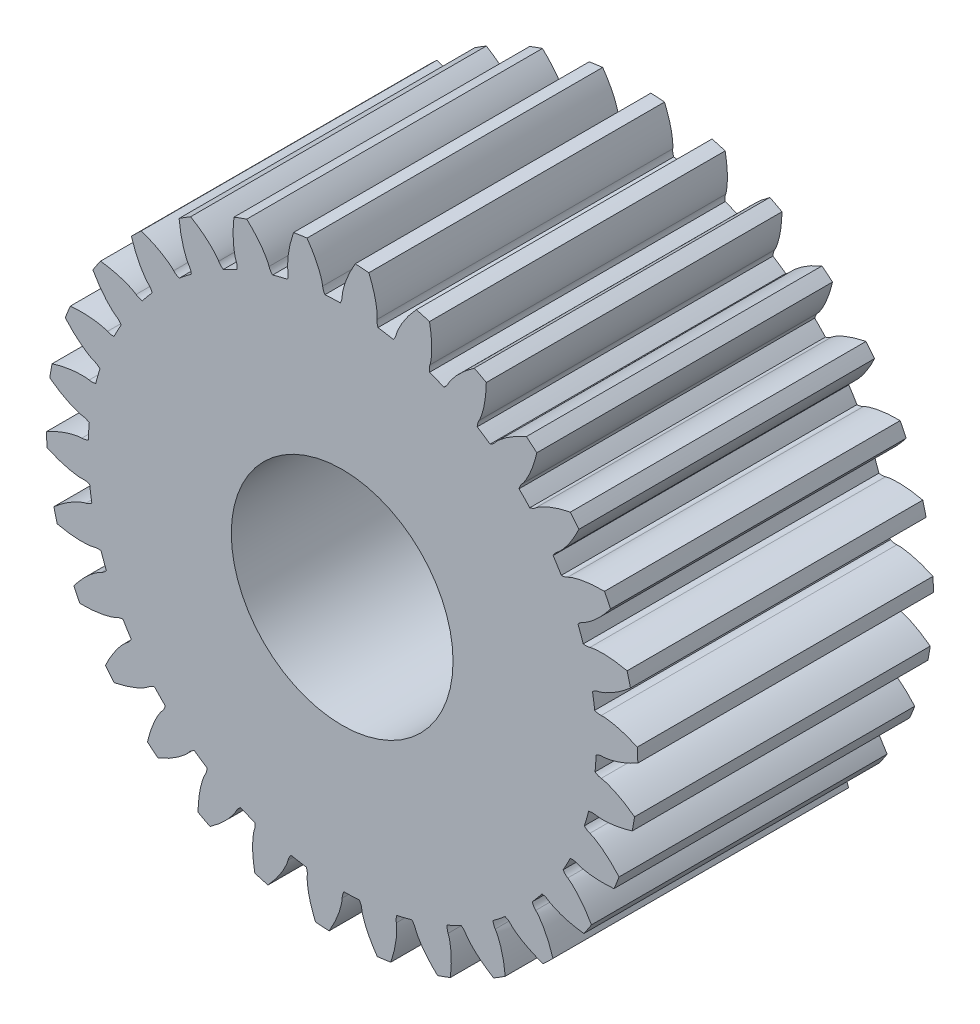
from build123d import *

# Parameters (mm, degrees)
EXTRUDE_1_DEPTH     = 8
SKETCH_4_R          = 3
CUT_EXTRUDE_1_DEPTH = 14.851437199


with BuildPart() as part:
    # 草图3 → 凸台-拉伸1 (new body)
    with BuildSketch(Plane.XY):
        with BuildLine():
            ThreePointArc((1.381076377, 6.734853602), (1.176200607, 6.773638397), (0.970242882, 6.806192309))
            add(Edge.make_bspline(
                [(0.944497299, 6.984119444), (0.936839109, 6.916691873), (0.949749676, 6.866361496), (0.970242882, 6.806192309)],
                knots=[0, 0, 0, 0, 1, 1, 1, 1], degree=3))
            add(Edge.make_bspline(
                [(0.944497299, 6.984119444), (0.945142268, 6.989798162), (0.946561124, 7.00576453), (0.947701168, 7.0360839), (0.947363048, 7.085626133), (0.943703552, 7.14876082), (0.935270102, 7.23020177), (0.92058926, 7.325773574), (0.899506223, 7.430213644), (0.871268355, 7.542993484), (0.838441416, 7.654599195), (0.801404333, 7.764937365), (0.767068505, 7.856734121), (0.741218568, 7.920699628), (0.725758466, 7.957461835), (0.72153722, 7.96739506)],
                knots=[0, 0, 0, 0, 0, 0.005376748, 0.015083688, 0.02853182, 0.046610139, 0.064854849, 0.092110525, 0.119476175, 0.146842495, 0.174208853, 0.201574955, 0.228941013, 0.239096509, 0.239096509, 0.239096509, 0.239096509, 0.239096509], degree=4))
            ThreePointArc((0.72153722, 7.96739506), (0.537273302, 7.981938198), (0.352722576, 7.992220391))
            add(Edge.make_bspline(
                [(3e-09, 7.047694627), (0.000121885, 7.053408555), (0.000855562, 7.069421043), (0.003789055, 7.099619693), (0.01076353, 7.148669708), (0.022851015, 7.210744448), (0.042122704, 7.290320534), (0.069479177, 7.383062758), (0.104368573, 7.48373526), (0.147465914, 7.591713447), (0.194953579, 7.697913091), (0.246443538, 7.802292404), (0.292771781, 7.888659571), (0.326960876, 7.948583782), (0.347208206, 7.982942482), (0.352722576, 7.992220391)],
                knots=[0, 0, 0, 0, 0, 0.005376748, 0.015083688, 0.02853182, 0.046610139, 0.064854849, 0.092110525, 0.119476175, 0.146842495, 0.174208853, 0.201574955, 0.228941013, 0.239096509, 0.239096509, 0.239096509, 0.239096509, 0.239096509], degree=4))
            add(Edge.make_bspline(
                [(3e-09, 7.047694627), (-0.001447201, 6.979848988), (-0.020986335, 6.931702837), (-0.049358256, 6.874822817)],
                knots=[0, 0, 0, 0, 1, 1, 1, 1], degree=3))
            ThreePointArc((-0.049358256, 6.874822817), (-0.257820811, 6.870164003), (-0.466046203, 6.859185516))
            add(Edge.make_bspline(
                [(-0.528222316, 7.027871708), (-0.521694176, 6.960325364), (-0.498601461, 6.913779085), (-0.466046203, 6.859185516)],
                knots=[0, 0, 0, 0, 1, 1, 1, 1], degree=3))
            add(Edge.make_bspline(
                [(-0.528222316, 7.027871708), (-0.528772113, 7.033560429), (-0.530703857, 7.04947289), (-0.535892477, 7.079366737), (-0.546523617, 7.127756055), (-0.563229584, 7.188750246), (-0.588411269, 7.266658103), (-0.622641795, 7.357089115), (-0.664978428, 7.454863509), (-0.716047479, 7.559307856), (-0.771361202, 7.66164961), (-0.830529531, 7.761876183), (-0.883200657, 7.84452814), (-0.921784888, 7.901721343), (-0.944550442, 7.934465872), (-0.950744678, 7.943304385)],
                knots=[0, 0, 0, 0, 0, 0.005376748, 0.015083688, 0.02853182, 0.046610139, 0.064854849, 0.092110525, 0.119476175, 0.146842495, 0.174208853, 0.201574955, 0.228941013, 0.239096509, 0.239096509, 0.239096509, 0.239096509, 0.239096509], degree=4))
            ThreePointArc((-0.950744678, 7.943304385), (-1.134005675, 7.919219098), (-1.316661313, 7.890906348))
            add(Edge.make_bspline(
                [(-1.465298104, 6.893685591), (-1.466366877, 6.899299996), (-1.468978416, 6.915115113), (-1.47238768, 6.945263758), (-1.475763685, 6.994691987), (-1.476846405, 7.057923374), (-1.474540646, 7.139767341), (-1.467064171, 7.236170656), (-1.453868183, 7.341897136), (-1.434162549, 7.456476181), (-1.409792751, 7.570228348), (-1.38112965, 7.683032088), (-1.353770534, 7.777144108), (-1.332787498, 7.842867144), (-1.320126195, 7.880684681), (-1.316661313, 7.890906348)],
                knots=[0, 0, 0, 0, 0, 0.005376748, 0.015083688, 0.02853182, 0.046610139, 0.064854849, 0.092110525, 0.119476175, 0.146842495, 0.174208853, 0.201574955, 0.228941013, 0.239096509, 0.239096509, 0.239096509, 0.239096509, 0.239096509], degree=4))
            add(Edge.make_bspline(
                [(-1.465298104, 6.893685591), (-1.452607781, 6.827021651), (-1.46170979, 6.775865195), (-1.477635695, 6.714329285)],
                knots=[0, 0, 0, 0, 1, 1, 1, 1], degree=3))
            ThreePointArc((-1.477635695, 6.714329285), (-1.680574221, 6.666430476), (-1.881966834, 6.612399401))
            add(Edge.make_bspline(
                [(-1.977856081, 6.764472255), (-1.957426921, 6.699759237), (-1.925161323, 6.659031351), (-1.881966834, 6.612399401)],
                knots=[0, 0, 0, 0, 1, 1, 1, 1], degree=3))
            add(Edge.make_bspline(
                [(-1.977856081, 6.764472255), (-1.979576615, 6.769922354), (-1.984774532, 6.785085458), (-1.996065049, 6.813247278), (-2.016524578, 6.858368835), (-2.045546885, 6.91455679), (-2.086376244, 6.985526607), (-2.138660415, 7.066864558), (-2.20040033, 7.153700066), (-2.272068601, 7.2452442), (-2.347451634, 7.333849172), (-2.426165269, 7.419583766), (-2.494869713, 7.489478637), (-2.544501921, 7.537399919), (-2.573577964, 7.564695676), (-2.581474471, 7.572053193)],
                knots=[0, 0, 0, 0, 0, 0.005376748, 0.015083688, 0.02853182, 0.046610139, 0.064854849, 0.092110525, 0.119476175, 0.146842495, 0.174208853, 0.201574955, 0.228941013, 0.239096509, 0.239096509, 0.239096509, 0.239096509, 0.239096509], degree=4))
            ThreePointArc((-2.581474471, 7.572053193), (-2.755723163, 7.510392124), (-2.928500785, 7.444721832))
            add(Edge.make_bspline(
                [(-2.866555652, 6.438389415), (-2.86876837, 6.443658921), (-2.874610989, 6.458585471), (-2.884214007, 6.487366469), (-2.897792945, 6.535012662), (-2.91199855, 6.596637181), (-2.926759496, 6.677172056), (-2.939489775, 6.773023174), (-2.948563922, 6.879182876), (-2.953111226, 6.995355126), (-2.952924373, 7.111688301), (-2.948340846, 7.227986403), (-2.941146581, 7.325730129), (-2.934286662, 7.394379578), (-2.929764747, 7.434003143), (-2.928500785, 7.444721832)],
                knots=[0, 0, 0, 0, 0, 0.005376748, 0.015083688, 0.02853182, 0.046610139, 0.064854849, 0.092110525, 0.119476175, 0.146842495, 0.174208853, 0.201574955, 0.228941013, 0.239096509, 0.239096509, 0.239096509, 0.239096509, 0.239096509], degree=4))
            add(Edge.make_bspline(
                [(-2.866555652, 6.438389415), (-2.84028243, 6.375820708), (-2.838549514, 6.323889729), (-2.841333365, 6.260387345)],
                knots=[0, 0, 0, 0, 1, 1, 1, 1], degree=3))
            ThreePointArc((-2.841333365, 6.260387345), (-3.029878474, 6.171341947), (-3.215636483, 6.076619703))
            add(Edge.make_bspline(
                [(-3.341048044, 6.205432904), (-3.307610718, 6.146381482), (-3.267582396, 6.113251993), (-3.215636483, 6.076619703)],
                knots=[0, 0, 0, 0, 1, 1, 1, 1], degree=3))
            add(Edge.make_bspline(
                [(-3.341048044, 6.205432904), (-3.34386412, 6.210406187), (-3.352101037, 6.224157233), (-3.369, 6.249356219), (-3.398393738, 6.289237986), (-3.438463971, 6.338164023), (-3.493156565, 6.399094078), (-3.561209313, 6.467784109), (-3.63965418, 6.539885602), (-3.728789423, 6.614528607), (-3.820947165, 6.685524333), (-3.915765943, 6.753019936), (-3.997500991, 6.807102979), (-4.056012011, 6.843657949), (-4.090127779, 6.86431198), (-4.099381443, 6.869866941)],
                knots=[0, 0, 0, 0, 0, 0.005376748, 0.015083688, 0.02853182, 0.046610139, 0.064854849, 0.092110525, 0.119476175, 0.146842495, 0.174208853, 0.201574955, 0.228941013, 0.239096509, 0.239096509, 0.239096509, 0.239096509, 0.239096509], degree=4))
            ThreePointArc((-4.099381443, 6.869866941), (-4.257002325, 6.773324974), (-4.412350721, 6.673167248))
            add(Edge.make_bspline(
                [(-4.142530962, 5.701704726), (-4.14579092, 5.706399031), (-4.154609267, 5.719784651), (-4.169986343, 5.745940136), (-4.193174749, 5.789721925), (-4.219882385, 5.84704629), (-4.25106491, 5.922752311), (-4.283445571, 6.013862078), (-4.314393269, 6.115815315), (-4.342994773, 6.228503484), (-4.36699903, 6.34233335), (-4.386695399, 6.457043028), (-4.39998041, 6.554146591), (-4.407543419, 6.622722142), (-4.411358521, 6.662419996), (-4.412350721, 6.673167248)],
                knots=[0, 0, 0, 0, 0, 0.005376748, 0.015083688, 0.02853182, 0.046610139, 0.064854849, 0.092110525, 0.119476175, 0.146842495, 0.174208853, 0.201574955, 0.228941013, 0.239096509, 0.239096509, 0.239096509, 0.239096509, 0.239096509], degree=4))
            add(Edge.make_bspline(
                [(-4.142530962, 5.701704726), (-4.103823108, 5.645965806), (-4.091331002, 5.595529937), (-4.080851131, 5.532836437)],
                knots=[0, 0, 0, 0, 1, 1, 1, 1], degree=3))
            ThreePointArc((-4.080851131, 5.532836437), (-4.246762499, 5.406536162), (-4.408767388, 5.275262564))
            add(Edge.make_bspline(
                [(-4.558220175, 5.375186359), (-4.513236054, 5.324377363), (-4.467194439, 5.300294189), (-4.408767388, 5.275262564)],
                knots=[0, 0, 0, 0, 1, 1, 1, 1], degree=3))
            add(Edge.make_bspline(
                [(-4.558220175, 5.375186359), (-4.562008717, 5.379465468), (-4.572924641, 5.391203469), (-4.594693485, 5.412338305), (-4.631736785, 5.445237258), (-4.681103682, 5.484763074), (-4.747269183, 5.532990431), (-4.828116275, 5.586030459), (-4.919837677, 5.640246757), (-5.022544254, 5.694726373), (-5.12744897, 5.745010001), (-5.234228855, 5.79131673), (-5.325422293, 5.827224257), (-5.390254912, 5.850815288), (-5.427919384, 5.863924912), (-5.438125774, 5.867434539)],
                knots=[0, 0, 0, 0, 0, 0.005376748, 0.015083688, 0.02853182, 0.046610139, 0.064854849, 0.092110525, 0.119476175, 0.146842495, 0.174208853, 0.201574955, 0.228941013, 0.239096509, 0.239096509, 0.239096509, 0.239096509, 0.239096509], degree=4))
            ThreePointArc((-5.438125774, 5.867434539), (-5.572230059, 5.740231021), (-5.703359757, 5.609963234))
            add(Edge.make_bspline(
                [(-5.237457792, 4.715828181), (-5.241622512, 4.719742122), (-5.253031184, 4.731001796), (-5.273510265, 4.753388647), (-5.305294695, 4.791392558), (-5.343337111, 4.841911418), (-5.38957839, 4.909479869), (-5.440194241, 4.991866351), (-5.491662928, 5.085157277), (-5.543068608, 5.189436353), (-5.590214874, 5.295787997), (-5.633330313, 5.403895888), (-5.666513981, 5.496115396), (-5.688169379, 5.561619969), (-5.70015476, 5.599657125), (-5.703359757, 5.609963234)],
                knots=[0, 0, 0, 0, 0, 0.005376748, 0.015083688, 0.02853182, 0.046610139, 0.064854849, 0.092110525, 0.119476175, 0.146842495, 0.174208853, 0.201574955, 0.228941013, 0.239096509, 0.239096509, 0.239096509, 0.239096509, 0.239096509], degree=4))
            add(Edge.make_bspline(
                [(-5.237457792, 4.715828181), (-5.188007024, 4.669355106), (-5.165301694, 4.622618636), (-5.142016122, 4.563474028)],
                knots=[0, 0, 0, 0, 1, 1, 1, 1], degree=3))
            ThreePointArc((-5.142016122, 4.563474028), (-5.278042624, 4.405438804), (-5.409214002, 4.243351139))
            add(Edge.make_bspline(
                [(-5.576176212, 4.310018377), (-5.521611318, 4.269672404), (-5.471568649, 4.255688095), (-5.409214002, 4.243351139)],
                knots=[0, 0, 0, 0, 1, 1, 1, 1], degree=3))
            add(Edge.make_bspline(
                [(-5.576176212, 4.310018377), (-5.580771642, 4.313416295), (-5.593889494, 4.322628245), (-5.619576816, 4.338775236), (-5.662650709, 4.363253533), (-5.7191567, 4.39165166), (-5.793903357, 4.425068553), (-5.884011388, 4.460140472), (-5.98500066, 4.494102062), (-6.096789801, 4.526037271), (-6.209856651, 4.553411163), (-6.32393085, 4.576505193), (-6.420597087, 4.592667873), (-6.488917809, 4.602263924), (-6.528484866, 4.607256186), (-6.539197914, 4.608567092)],
                knots=[0, 0, 0, 0, 0, 0.005376748, 0.015083688, 0.02853182, 0.046610139, 0.064854849, 0.092110525, 0.119476175, 0.146842495, 0.174208853, 0.201574955, 0.228941013, 0.239096509, 0.239096509, 0.239096509, 0.239096509, 0.239096509], degree=4))
            ThreePointArc((-6.539197914, 4.608567092), (-6.6439246, 4.456261428), (-6.745104603, 4.301576907))
            add(Edge.make_bspline(
                [(-6.103482584, 3.523847316), (-6.108370049, 3.526809833), (-6.121870432, 3.53545146), (-6.146556484, 3.553091264), (-6.185547805, 3.583656344), (-6.233262365, 3.625161783), (-6.292541432, 3.681639599), (-6.359180318, 3.751702111), (-6.428920564, 3.832253465), (-6.500883746, 3.923565951), (-6.569111503, 4.017791297), (-6.633761661, 4.114572567), (-6.6853937, 4.197877586), (-6.720195042, 4.257448316), (-6.739826883, 4.292162368), (-6.745104603, 4.301576907)],
                knots=[0, 0, 0, 0, 0, 0.005376748, 0.015083688, 0.02853182, 0.046610139, 0.064854849, 0.092110525, 0.119476175, 0.146842495, 0.174208853, 0.201574955, 0.228941013, 0.239096509, 0.239096509, 0.239096509, 0.239096509, 0.239096509], degree=4))
            add(Edge.make_bspline(
                [(-6.103482584, 3.523847316), (-6.045450138, 3.488671181), (-6.013523916, 3.44767672), (-5.978450334, 3.394665905)],
                knots=[0, 0, 0, 0, 1, 1, 1, 1], degree=3))
            ThreePointArc((-5.978450334, 3.394665905), (-6.07864696, 3.21180263), (-6.173252007, 3.025984906))
            add(Edge.make_bspline(
                [(-6.350426592, 3.05648191), (-6.288665672, 3.028362273), (-6.236809054, 3.02508801), (-6.173252007, 3.025984906)],
                knots=[0, 0, 0, 0, 1, 1, 1, 1], degree=3))
            add(Edge.make_bspline(
                [(-6.350426592, 3.05648191), (-6.355628067, 3.058850132), (-6.370374535, 3.065133423), (-6.398857676, 3.07558687), (-6.446079624, 3.090574691), (-6.507255126, 3.106603995), (-6.587316152, 3.123749944), (-6.682746969, 3.139320946), (-6.788590394, 3.151543543), (-6.904576378, 3.159538621), (-7.020863798, 3.162806408), (-7.137246721, 3.161678419), (-7.235160979, 3.157389864), (-7.30398386, 3.152571542), (-7.343724231, 3.149228258), (-7.354475727, 3.148283149)],
                knots=[0, 0, 0, 0, 0, 0.005376748, 0.015083688, 0.02853182, 0.046610139, 0.064854849, 0.092110525, 0.119476175, 0.146842495, 0.174208853, 0.201574955, 0.228941013, 0.239096509, 0.239096509, 0.239096509, 0.239096509, 0.239096509], degree=4))
            ThreePointArc((-7.354475727, 3.148283149), (-7.425247755, 2.977531827), (-7.492056012, 2.805191028))
            add(Edge.make_bspline(
                [(-6.702755899, 2.177857413), (-6.708152503, 2.179739031), (-6.723154566, 2.185384931), (-6.75096869, 2.197506744), (-6.795462795, 2.219297152), (-6.850764142, 2.249975183), (-6.920490218, 2.292894012), (-7.0002397, 2.347570487), (-7.085203523, 2.411861788), (-7.17457907, 2.48621689), (-7.260906438, 2.564197837), (-7.344265792, 2.645422681), (-7.412089634, 2.716172381), (-7.458515934, 2.767205741), (-7.48493623, 2.797079519), (-7.492056012, 2.805191028)],
                knots=[0, 0, 0, 0, 0, 0.005376748, 0.015083688, 0.02853182, 0.046610139, 0.064854849, 0.092110525, 0.119476175, 0.146842495, 0.174208853, 0.201574955, 0.228941013, 0.239096509, 0.239096509, 0.239096509, 0.239096509, 0.239096509], degree=4))
            add(Edge.make_bspline(
                [(-6.702755899, 2.177857413), (-6.638678072, 2.155515586), (-6.598926286, 2.122054786), (-6.553597578, 2.077494593)],
                knots=[0, 0, 0, 0, 1, 1, 1, 1], degree=3))
            ThreePointArc((-6.553597578, 2.077494593), (-6.613585255, 1.877795269), (-6.667489278, 1.676368613))
            add(Edge.make_bspline(
                [(-6.847132856, 1.669362516), (-6.780875159, 1.654698179), (-6.729470976, 1.662277064), (-6.667489278, 1.676368613)],
                knots=[0, 0, 0, 0, 1, 1, 1, 1], degree=3))
            add(Edge.make_bspline(
                [(-6.847132856, 1.669362516), (-6.852713048, 1.67059754), (-6.86844364, 1.673677563), (-6.898477749, 1.677980599), (-6.947783928, 1.682822905), (-7.010955278, 1.685782828), (-7.092831622, 1.685908474), (-7.18941444, 1.681298029), (-7.295486153, 1.671247448), (-7.410599835, 1.654952973), (-7.525025507, 1.633971837), (-7.638630662, 1.608671126), (-7.733513618, 1.584118768), (-7.799830769, 1.565096656), (-7.838007609, 1.553563943), (-7.848327659, 1.550404125)],
                knots=[0, 0, 0, 0, 0, 0.005376748, 0.015083688, 0.02853182, 0.046610139, 0.064854849, 0.092110525, 0.119476175, 0.146842495, 0.174208853, 0.201574955, 0.228941013, 0.239096509, 0.239096509, 0.239096509, 0.239096509, 0.239096509], degree=4))
            ThreePointArc((-7.848327659, 1.550404125), (-7.882051953, 1.368669797), (-7.911568623, 1.186204841))
            add(Edge.make_bspline(
                [(-7.009086618, 0.736684692), (-7.014756504, 0.737403175), (-7.030604584, 0.739806593), (-7.06033117, 0.745880634), (-7.108383452, 0.757944025), (-7.168854654, 0.77645387), (-7.245980373, 0.803937954), (-7.335355016, 0.840838767), (-7.431829089, 0.886060177), (-7.534710861, 0.940208221), (-7.635364919, 0.998536628), (-7.733790266, 1.06065513), (-7.814841684, 1.115757409), (-7.870863891, 1.156022998), (-7.902917947, 1.179750873), (-7.911568623, 1.186204841)],
                knots=[0, 0, 0, 0, 0, 0.005376748, 0.015083688, 0.02853182, 0.046610139, 0.064854849, 0.092110525, 0.119476175, 0.146842495, 0.174208853, 0.201574955, 0.228941013, 0.239096509, 0.239096509, 0.239096509, 0.239096509, 0.239096509], degree=4))
            add(Edge.make_bspline(
                [(-7.009086618, 0.736684692), (-6.941763918, 0.728153616), (-6.895923913, 0.703688876), (-6.842321161, 0.669526798)],
                knots=[0, 0, 0, 0, 1, 1, 1, 1], degree=3))
            ThreePointArc((-6.842321161, 0.669526798), (-6.859478139, 0.461719244), (-6.870325273, 0.253486968))
            add(Edge.make_bspline(
                [(-7.044586558, 0.209283971), (-6.976727864, 0.208715834), (-6.928022724, 0.226816633), (-6.870325273, 0.253486968)],
                knots=[0, 0, 0, 0, 1, 1, 1, 1], degree=3))
            add(Edge.make_bspline(
                [(-7.044586558, 0.209283971), (-7.050301585, 0.209331819), (-7.066328799, 0.209073963), (-7.096601243, 0.207038524), (-7.145836736, 0.201523683), (-7.208243042, 0.191284863), (-7.288356315, 0.174384714), (-7.381870001, 0.149794321), (-7.48353416, 0.11790982), (-7.592744519, 0.078037938), (-7.700307493, 0.033724855), (-7.806169789, -0.014642814), (-7.893874602, -0.05838592), (-7.954787644, -0.090780465), (-7.989732444, -0.109998572), (-7.999170013, -0.115234999)],
                knots=[0, 0, 0, 0, 0, 0.005376748, 0.015083688, 0.02853182, 0.046610139, 0.064854849, 0.092110525, 0.119476175, 0.146842495, 0.174208853, 0.201574955, 0.228941013, 0.239096509, 0.239096509, 0.239096509, 0.239096509, 0.239096509], degree=4))
            ThreePointArc((-7.999170013, -0.115234999), (-7.994372658, -0.300009671), (-7.985307721, -0.48462419))
            add(Edge.make_bspline(
                [(-7.009086619, -0.736684686), (-7.014781985, -0.737160739), (-7.030783446, -0.738104842), (-7.061123298, -0.738344038), (-7.110633643, -0.736534893), (-7.173631816, -0.731002202), (-7.254786416, -0.72015405), (-7.34988012, -0.702641642), (-7.453648062, -0.678466516), (-7.565539631, -0.646892059), (-7.676121315, -0.610765423), (-7.785310995, -0.57046814), (-7.876047653, -0.533421515), (-7.939217327, -0.505683498), (-7.975504228, -0.489138546), (-7.985307721, -0.48462419)],
                knots=[0, 0, 0, 0, 0, 0.005376748, 0.015083688, 0.02853182, 0.046610139, 0.064854849, 0.092110525, 0.119476175, 0.146842495, 0.174208853, 0.201574955, 0.228941013, 0.239096509, 0.239096509, 0.239096509, 0.239096509, 0.239096509], degree=4))
            add(Edge.make_bspline(
                [(-7.009086619, -0.736684686), (-6.941461371, -0.731032161), (-6.891536574, -0.745431615), (-6.832002475, -0.76770253)],
                knots=[0, 0, 0, 0, 1, 1, 1, 1], degree=3))
            ThreePointArc((-6.832002475, -0.76770253), (-6.805578913, -0.974536127), (-6.772895086, -1.180473275))
            add(Edge.make_bspline(
                [(-6.934158024, -1.259941289), (-6.867664083, -1.246388395), (-6.823786635, -1.218556773), (-6.772895086, -1.180473275)],
                knots=[0, 0, 0, 0, 1, 1, 1, 1], degree=3))
            add(Edge.make_bspline(
                [(-6.934158024, -1.259941289), (-6.939758113, -1.261082707), (-6.955381482, -1.264667174), (-6.984569208, -1.272952128), (-7.031582188, -1.288583091), (-7.090495997, -1.311573169), (-7.165344864, -1.344760495), (-7.251702421, -1.388256117), (-7.344515813, -1.440581033), (-7.443049834, -1.502287729), (-7.539049091, -1.567996065), (-7.632541837, -1.637316793), (-7.709235387, -1.698338863), (-7.762082129, -1.742690043), (-7.792267631, -1.76875362), (-7.800410253, -1.7758378)],
                knots=[0, 0, 0, 0, 0, 0.005376748, 0.015083688, 0.02853182, 0.046610139, 0.064854849, 0.092110525, 0.119476175, 0.146842495, 0.174208853, 0.201574955, 0.228941013, 0.239096509, 0.239096509, 0.239096509, 0.239096509, 0.239096509], degree=4))
            ThreePointArc((-7.800410253, -1.7758378), (-7.757300917, -1.955577276), (-7.710050553, -2.134272819))
            add(Edge.make_bspline(
                [(-6.702755901, -2.177857409), (-6.708227833, -2.179507192), (-6.723683333, -2.183757555), (-6.753310455, -2.190299534), (-6.802115022, -2.198823701), (-6.864886846, -2.20650997), (-6.946523481, -2.212771867), (-7.043180193, -2.215413239), (-7.149706848, -2.213340966), (-7.265718017, -2.205720053), (-7.381394376, -2.193374095), (-7.496576275, -2.176659215), (-7.593032546, -2.15928736), (-7.660588869, -2.145289199), (-7.699522703, -2.136650265), (-7.710050553, -2.134272819)],
                knots=[0, 0, 0, 0, 0, 0.005376748, 0.015083688, 0.02853182, 0.046610139, 0.064854849, 0.092110525, 0.119476175, 0.146842495, 0.174208853, 0.201574955, 0.228941013, 0.239096509, 0.239096509, 0.239096509, 0.239096509, 0.239096509], degree=4))
            add(Edge.make_bspline(
                [(-6.702755901, -2.177857409), (-6.637783653, -2.158268325), (-6.585956018, -2.161973167), (-6.523092498, -2.171379574)],
                knots=[0, 0, 0, 0, 1, 1, 1, 1], degree=3))
            ThreePointArc((-6.523092498, -2.171379574), (-6.454243231, -2.368199593), (-6.379456884, -2.562841171))
            add(Edge.make_bspline(
                [(-6.520673511, -2.674101068), (-6.458450427, -2.647019469), (-6.421318326, -2.610673401), (-6.379456884, -2.562841171)],
                knots=[0, 0, 0, 0, 1, 1, 1, 1], degree=3))
            add(Edge.make_bspline(
                [(-6.520673511, -2.674101068), (-6.52591391, -2.676381867), (-6.540450618, -2.683136286), (-6.567277984, -2.697308663), (-6.610013757, -2.7223726), (-6.662860252, -2.75710916), (-6.729173458, -2.805133218), (-6.804600648, -2.865633102), (-6.884506883, -2.936111582), (-6.968058155, -3.016956214), (-7.048298067, -3.101188032), (-7.125335183, -3.188432171), (-7.187665592, -3.264066248), (-7.230136378, -3.318435704), (-7.254243332, -3.350205649), (-7.260735134, -3.358827968)],
                knots=[0, 0, 0, 0, 0, 0.005376748, 0.015083688, 0.02853182, 0.046610139, 0.064854849, 0.092110525, 0.119476175, 0.146842495, 0.174208853, 0.201574955, 0.228941013, 0.239096509, 0.239096509, 0.239096509, 0.239096509, 0.239096509], degree=4))
            ThreePointArc((-7.260735134, -3.358827968), (-7.181197902, -3.52567677), (-7.09782718, -3.690643484))
            add(Edge.make_bspline(
                [(-6.103482587, -3.523847311), (-6.108491934, -3.526598722), (-6.122725994, -3.533969583), (-6.150345539, -3.546528429), (-6.196311335, -3.565013363), (-6.256113379, -3.585582665), (-6.334664136, -3.608680935), (-6.428659495, -3.631360647), (-6.533289137, -3.651481795), (-6.64834966, -3.668147495), (-6.764065082, -3.680121794), (-6.880205199, -3.687719837), (-6.978165481, -3.690781985), (-7.047155917, -3.691135467), (-7.087035089, -3.690780114), (-7.09782718, -3.690643484)],
                knots=[0, 0, 0, 0, 0, 0.005376748, 0.015083688, 0.02853182, 0.046610139, 0.064854849, 0.092110525, 0.119476175, 0.146842495, 0.174208853, 0.201574955, 0.228941013, 0.239096509, 0.239096509, 0.239096509, 0.239096509, 0.239096509], degree=4))
            add(Edge.make_bspline(
                [(-6.103482587, -3.523847311), (-6.044002938, -3.491177806), (-5.992537581, -3.484026118), (-5.929092078, -3.480156912)],
                knots=[0, 0, 0, 0, 1, 1, 1, 1], degree=3))
            ThreePointArc((-5.929092078, -3.480156912), (-5.82082615, -3.658361373), (-5.707205804, -3.833200609))
            add(Edge.make_bspline(
                [(-5.822204276, -3.971389798), (-5.766971496, -3.931963091), (-5.738207593, -3.888691074), (-5.707205804, -3.833200609)],
                knots=[0, 0, 0, 0, 1, 1, 1, 1], degree=3))
            add(Edge.make_bspline(
                [(-5.822204276, -3.971389798), (-5.826855954, -3.974710297), (-5.839670678, -3.984339467), (-5.862965199, -4.003779867), (-5.899556007, -4.037181364), (-5.944025542, -4.082146251), (-5.998904883, -4.142908158), (-6.060105174, -4.217768169), (-6.123611967, -4.303319966), (-6.188528899, -4.399769235), (-6.249502596, -4.498843202), (-6.30671719, -4.600197764), (-6.351960321, -4.687138276), (-6.382198973, -4.749149801), (-6.399173789, -4.785237614), (-6.403731049, -4.795021236)],
                knots=[0, 0, 0, 0, 0, 0.005376748, 0.015083688, 0.02853182, 0.046610139, 0.064854849, 0.092110525, 0.119476175, 0.146842495, 0.174208853, 0.201574955, 0.228941013, 0.239096509, 0.239096509, 0.239096509, 0.239096509, 0.239096509], degree=4))
            ThreePointArc((-6.403731049, -4.795021236), (-6.29124208, -4.941687272), (-6.175394699, -5.085715319))
            add(Edge.make_bspline(
                [(-5.237457795, -4.715828177), (-5.241785627, -4.719560965), (-5.25417615, -4.729730182), (-5.27858101, -4.747757014), (-5.31969911, -4.775394835), (-5.373917737, -4.807948191), (-5.445949571, -4.846873329), (-5.533175529, -4.888600169), (-5.63133534, -4.930035348), (-5.740416521, -4.970259291), (-5.851113687, -5.006030511), (-5.963136141, -5.037609407), (-6.0583191, -5.060971728), (-6.125728437, -5.075661403), (-6.164810035, -5.083605161), (-6.175394699, -5.085715319)],
                knots=[0, 0, 0, 0, 0, 0.005376748, 0.015083688, 0.02853182, 0.046610139, 0.064854849, 0.092110525, 0.119476175, 0.146842495, 0.174208853, 0.201574955, 0.228941013, 0.239096509, 0.239096509, 0.239096509, 0.239096509, 0.239096509], degree=4))
            add(Edge.make_bspline(
                [(-5.237457795, -4.715828177), (-5.186070292, -4.671506065), (-5.137216496, -4.653810409), (-5.075961883, -4.636834692)],
                knots=[0, 0, 0, 0, 1, 1, 1, 1], degree=3))
            ThreePointArc((-5.075961883, -4.636834692), (-4.933011034, -4.788635207), (-4.785522444, -4.936030788))
            add(Edge.make_bspline(
                [(-4.869276775, -5.095109738), (-4.823448238, -5.045061059), (-4.804309653, -4.996754287), (-4.785522444, -4.936030788)],
                knots=[0, 0, 0, 0, 1, 1, 1, 1], degree=3))
            add(Edge.make_bspline(
                [(-4.869276775, -5.095109738), (-4.873136433, -5.099324814), (-4.883669107, -5.111407895), (-4.9024127, -5.135266679), (-4.93125935, -5.175545929), (-4.965408394, -5.228773962), (-5.006455378, -5.299618132), (-5.050754025, -5.385566528), (-5.095085823, -5.482452617), (-5.138531234, -5.590291228), (-5.177573873, -5.699877335), (-5.212465393, -5.81091264), (-5.238643904, -5.905359869), (-5.255328847, -5.972303263), (-5.264429645, -6.011131733), (-5.266853188, -6.021649068)],
                knots=[0, 0, 0, 0, 0, 0.005376748, 0.015083688, 0.02853182, 0.046610139, 0.064854849, 0.092110525, 0.119476175, 0.146842495, 0.174208853, 0.201574955, 0.228941013, 0.239096509, 0.239096509, 0.239096509, 0.239096509, 0.239096509], degree=4))
            ThreePointArc((-5.266853188, -6.021649068), (-5.12632879, -6.141722327), (-4.983067838, -6.258516991))
            add(Edge.make_bspline(
                [(-4.142530967, -5.701704723), (-4.145988134, -5.706255747), (-4.155993596, -5.718778877), (-4.176117162, -5.741485835), (-4.210590507, -5.777068637), (-4.256856103, -5.820183311), (-4.319220878, -5.873234102), (-4.395865241, -5.932184406), (-4.483265167, -5.993122699), (-4.581599634, -6.055146905), (-4.682440546, -6.113151673), (-4.78544942, -6.167331273), (-4.873695103, -6.20997272), (-4.936577229, -6.23835658), (-4.9731532, -6.25425227), (-4.983067838, -6.258516991)],
                knots=[0, 0, 0, 0, 0, 0.005376748, 0.015083688, 0.02853182, 0.046610139, 0.064854849, 0.092110525, 0.119476175, 0.146842495, 0.174208853, 0.201574955, 0.228941013, 0.239096509, 0.239096509, 0.239096509, 0.239096509, 0.239096509], degree=4))
            add(Edge.make_bspline(
                [(-4.142530967, -5.701704723), (-4.101481488, -5.647667093), (-4.057374399, -5.620200853), (-4.000987796, -5.590860547)],
                knots=[0, 0, 0, 0, 1, 1, 1, 1], degree=3))
            ThreePointArc((-4.000987796, -5.590860547), (-3.829599665, -5.709622703), (-3.65468879, -5.823132735))
            add(Edge.make_bspline(
                [(-3.703538515, -5.996148933), (-3.669117146, -5.937665649), (-3.660440328, -5.886435361), (-3.65468879, -5.823132735)],
                knots=[0, 0, 0, 0, 1, 1, 1, 1], degree=3))
            add(Edge.make_bspline(
                [(-3.703538515, -5.996148933), (-3.706437466, -6.001074368), (-3.714227762, -6.01508327), (-3.727601243, -6.042317694), (-3.747442997, -6.087714303), (-3.769779072, -6.14687916), (-3.79519975, -6.224709364), (-3.820660688, -6.317989788), (-3.84387998, -6.421975782), (-3.863955096, -6.536490669), (-3.879360328, -6.651799478), (-3.890403845, -6.76766275), (-3.896373611, -6.865488899), (-3.898775634, -6.934438414), (-3.899604664, -6.974310551), (-3.89978857, -6.98510194)],
                knots=[0, 0, 0, 0, 0, 0.005376748, 0.015083688, 0.02853182, 0.046610139, 0.064854849, 0.092110525, 0.119476175, 0.146842495, 0.174208853, 0.201574955, 0.228941013, 0.239096509, 0.239096509, 0.239096509, 0.239096509, 0.239096509], degree=4))
            ThreePointArc((-3.89978857, -6.98510194), (-3.737370333, -7.073334645), (-3.572957, -7.157791438))
            add(Edge.make_bspline(
                [(-2.866555656, -6.438389413), (-2.868991066, -6.443559771), (-2.876174179, -6.457889494), (-2.891136955, -6.484284174), (-2.917458894, -6.526256818), (-2.953749431, -6.578048491), (-3.003721506, -6.642906361), (-3.066434548, -6.716503719), (-3.139254793, -6.79428183), (-3.222544859, -6.875395544), (-3.309122285, -6.953098773), (-3.398615596, -7.027511168), (-3.476067243, -7.087568106), (-3.531673908, -7.12840564), (-3.564145707, -7.151558543), (-3.572957, -7.157791438)],
                knots=[0, 0, 0, 0, 0, 0.005376748, 0.015083688, 0.02853182, 0.046610139, 0.064854849, 0.092110525, 0.119476175, 0.146842495, 0.174208853, 0.201574955, 0.228941013, 0.239096509, 0.239096509, 0.239096509, 0.239096509, 0.239096509], degree=4))
            add(Edge.make_bspline(
                [(-2.866555656, -6.438389413), (-2.837638263, -6.376997967), (-2.800205572, -6.340961552), (-2.751151344, -6.300538968)],
                knots=[0, 0, 0, 0, 1, 1, 1, 1], degree=3))
            ThreePointArc((-2.751151344, -6.300538968), (-2.558816414, -6.381072289), (-2.364127699, -6.455735839))
            add(Edge.make_bspline(
                [(-2.375937849, -6.635127647), (-2.354428029, -6.570765758), (-2.356592196, -6.518850962), (-2.364127699, -6.455735839)],
                knots=[0, 0, 0, 0, 1, 1, 1, 1], degree=3))
            add(Edge.make_bspline(
                [(-2.375937849, -6.635127647), (-2.377749396, -6.640548175), (-2.382456841, -6.655870643), (-2.389875724, -6.685290433), (-2.399845403, -6.733820349), (-2.409392315, -6.796336243), (-2.418075681, -6.877750926), (-2.423586146, -6.974286576), (-2.424678136, -7.080827789), (-2.42050558, -7.197014102), (-2.41160012, -7.313006065), (-2.398312982, -7.428633523), (-2.383813094, -7.52556312), (-2.371827216, -7.593505331), (-2.364348247, -7.632678532), (-2.362284478, -7.643272339)],
                knots=[0, 0, 0, 0, 0, 0.005376748, 0.015083688, 0.02853182, 0.046610139, 0.064854849, 0.092110525, 0.119476175, 0.146842495, 0.174208853, 0.201574955, 0.228941013, 0.239096509, 0.239096509, 0.239096509, 0.239096509, 0.239096509], degree=4))
            ThreePointArc((-2.362284478, -7.643272339), (-2.185070859, -7.695808297), (-2.006690797, -7.744236053))
            add(Edge.make_bspline(
                [(-1.465298109, -6.89368559), (-1.46660532, -6.899249313), (-1.470652148, -6.91475935), (-1.479800189, -6.94368818), (-1.496820327, -6.990216259), (-1.521549735, -7.048421388), (-1.556945091, -7.122251736), (-1.602985952, -7.20727959), (-1.658043921, -7.298498243), (-1.722649409, -7.395156406), (-1.791179502, -7.489162092), (-1.863245962, -7.580555103), (-1.926518565, -7.655402756), (-1.97241949, -7.706909167), (-1.999367943, -7.73630739), (-2.006690797, -7.744236053)],
                knots=[0, 0, 0, 0, 0, 0.005376748, 0.015083688, 0.02853182, 0.046610139, 0.064854849, 0.092110525, 0.119476175, 0.146842495, 0.174208853, 0.201574955, 0.228941013, 0.239096509, 0.239096509, 0.239096509, 0.239096509, 0.239096509], degree=4))
            add(Edge.make_bspline(
                [(-1.465298109, -6.89368559), (-1.449776629, -6.827623431), (-1.420654324, -6.784591803), (-1.381076377, -6.734853602)],
                knots=[0, 0, 0, 0, 1, 1, 1, 1], degree=3))
            ThreePointArc((-1.381076377, -6.734853602), (-1.176200607, -6.773638397), (-0.970242882, -6.806192309))
            add(Edge.make_bspline(
                [(-0.944497299, -6.984119444), (-0.936839109, -6.916691873), (-0.949749676, -6.866361496), (-0.970242882, -6.806192309)],
                knots=[0, 0, 0, 0, 1, 1, 1, 1], degree=3))
            add(Edge.make_bspline(
                [(-0.944497299, -6.984119444), (-0.945142268, -6.989798162), (-0.946561124, -7.00576453), (-0.947701168, -7.0360839), (-0.947363048, -7.085626133), (-0.943703552, -7.14876082), (-0.935270102, -7.23020177), (-0.92058926, -7.325773574), (-0.899506223, -7.430213644), (-0.871268355, -7.542993484), (-0.838441416, -7.654599195), (-0.801404333, -7.764937365), (-0.767068505, -7.856734121), (-0.741218568, -7.920699628), (-0.725758466, -7.957461835), (-0.72153722, -7.96739506)],
                knots=[0, 0, 0, 0, 0, 0.005376748, 0.015083688, 0.02853182, 0.046610139, 0.064854849, 0.092110525, 0.119476175, 0.146842495, 0.174208853, 0.201574955, 0.228941013, 0.239096509, 0.239096509, 0.239096509, 0.239096509, 0.239096509], degree=4))
            ThreePointArc((-0.72153722, -7.96739506), (-0.537273302, -7.981938198), (-0.352722576, -7.992220391))
            add(Edge.make_bspline(
                [(-3e-09, -7.047694627), (-0.000121885, -7.053408555), (-0.000855562, -7.069421043), (-0.003789055, -7.099619693), (-0.01076353, -7.148669708), (-0.022851015, -7.210744448), (-0.042122704, -7.290320534), (-0.069479177, -7.383062758), (-0.104368573, -7.48373526), (-0.147465914, -7.591713447), (-0.194953579, -7.697913091), (-0.246443538, -7.802292404), (-0.292771781, -7.888659571), (-0.326960876, -7.948583782), (-0.347208206, -7.982942482), (-0.352722576, -7.992220391)],
                knots=[0, 0, 0, 0, 0, 0.005376748, 0.015083688, 0.02853182, 0.046610139, 0.064854849, 0.092110525, 0.119476175, 0.146842495, 0.174208853, 0.201574955, 0.228941013, 0.239096509, 0.239096509, 0.239096509, 0.239096509, 0.239096509], degree=4))
            add(Edge.make_bspline(
                [(-3e-09, -7.047694627), (0.001447201, -6.979848988), (0.020986335, -6.931702837), (0.049358256, -6.874822817)],
                knots=[0, 0, 0, 0, 1, 1, 1, 1], degree=3))
            ThreePointArc((0.049358256, -6.874822817), (0.257820811, -6.870164003), (0.466046203, -6.859185516))
            add(Edge.make_bspline(
                [(0.528222316, -7.027871708), (0.521694176, -6.960325364), (0.498601461, -6.913779085), (0.466046203, -6.859185516)],
                knots=[0, 0, 0, 0, 1, 1, 1, 1], degree=3))
            add(Edge.make_bspline(
                [(0.528222316, -7.027871708), (0.528772113, -7.033560429), (0.530703857, -7.04947289), (0.535892477, -7.079366737), (0.546523617, -7.127756055), (0.563229584, -7.188750246), (0.588411269, -7.266658103), (0.622641795, -7.357089115), (0.664978428, -7.454863509), (0.716047479, -7.559307856), (0.771361202, -7.66164961), (0.830529531, -7.761876183), (0.883200657, -7.84452814), (0.921784888, -7.901721343), (0.944550442, -7.934465872), (0.950744678, -7.943304385)],
                knots=[0, 0, 0, 0, 0, 0.005376748, 0.015083688, 0.02853182, 0.046610139, 0.064854849, 0.092110525, 0.119476175, 0.146842495, 0.174208853, 0.201574955, 0.228941013, 0.239096509, 0.239096509, 0.239096509, 0.239096509, 0.239096509], degree=4))
            ThreePointArc((0.950744678, -7.943304385), (1.134005675, -7.919219098), (1.316661313, -7.890906348))
            add(Edge.make_bspline(
                [(1.465298104, -6.893685591), (1.466366877, -6.899299996), (1.468978416, -6.915115113), (1.47238768, -6.945263758), (1.475763685, -6.994691987), (1.476846405, -7.057923374), (1.474540647, -7.139767341), (1.467064171, -7.236170656), (1.453868183, -7.341897136), (1.434162549, -7.456476181), (1.409792751, -7.570228348), (1.38112965, -7.683032088), (1.353770534, -7.777144108), (1.332787498, -7.842867144), (1.320126195, -7.880684681), (1.316661313, -7.890906348)],
                knots=[0, 0, 0, 0, 0, 0.005376748, 0.015083688, 0.02853182, 0.046610139, 0.064854849, 0.092110525, 0.119476175, 0.146842495, 0.174208853, 0.201574955, 0.228941013, 0.239096509, 0.239096509, 0.239096509, 0.239096509, 0.239096509], degree=4))
            add(Edge.make_bspline(
                [(1.465298104, -6.893685591), (1.452607781, -6.827021651), (1.46170979, -6.775865195), (1.477635695, -6.714329285)],
                knots=[0, 0, 0, 0, 1, 1, 1, 1], degree=3))
            ThreePointArc((1.477635695, -6.714329285), (1.680574221, -6.666430476), (1.881966834, -6.612399401))
            add(Edge.make_bspline(
                [(1.977856081, -6.764472255), (1.957426921, -6.699759237), (1.925161323, -6.659031351), (1.881966834, -6.612399401)],
                knots=[0, 0, 0, 0, 1, 1, 1, 1], degree=3))
            add(Edge.make_bspline(
                [(1.977856081, -6.764472255), (1.979576615, -6.769922354), (1.984774532, -6.785085458), (1.996065049, -6.813247278), (2.016524578, -6.858368835), (2.045546885, -6.91455679), (2.086376244, -6.985526607), (2.138660415, -7.066864558), (2.20040033, -7.153700066), (2.272068601, -7.2452442), (2.347451634, -7.333849172), (2.426165269, -7.419583766), (2.494869713, -7.489478637), (2.544501921, -7.537399919), (2.573577964, -7.564695676), (2.581474471, -7.572053193)],
                knots=[0, 0, 0, 0, 0, 0.005376748, 0.015083688, 0.02853182, 0.046610139, 0.064854849, 0.092110525, 0.119476175, 0.146842495, 0.174208853, 0.201574955, 0.228941013, 0.239096509, 0.239096509, 0.239096509, 0.239096509, 0.239096509], degree=4))
            ThreePointArc((2.581474471, -7.572053193), (2.755723163, -7.510392124), (2.928500785, -7.444721832))
            add(Edge.make_bspline(
                [(2.866555652, -6.438389415), (2.86876837, -6.443658921), (2.874610989, -6.458585471), (2.884214007, -6.487366469), (2.897792945, -6.535012662), (2.91199855, -6.596637181), (2.926759496, -6.677172056), (2.939489775, -6.773023174), (2.948563922, -6.879182876), (2.953111226, -6.995355126), (2.952924373, -7.111688301), (2.948340846, -7.227986403), (2.941146581, -7.325730129), (2.934286662, -7.394379578), (2.929764747, -7.434003143), (2.928500785, -7.444721832)],
                knots=[0, 0, 0, 0, 0, 0.005376748, 0.015083688, 0.02853182, 0.046610139, 0.064854849, 0.092110525, 0.119476175, 0.146842495, 0.174208853, 0.201574955, 0.228941013, 0.239096509, 0.239096509, 0.239096509, 0.239096509, 0.239096509], degree=4))
            add(Edge.make_bspline(
                [(2.866555652, -6.438389415), (2.84028243, -6.375820708), (2.838549514, -6.323889729), (2.841333365, -6.260387345)],
                knots=[0, 0, 0, 0, 1, 1, 1, 1], degree=3))
            ThreePointArc((2.841333365, -6.260387345), (3.029878474, -6.171341947), (3.215636483, -6.076619703))
            add(Edge.make_bspline(
                [(3.341048044, -6.205432904), (3.307610718, -6.146381482), (3.267582396, -6.113251993), (3.215636483, -6.076619703)],
                knots=[0, 0, 0, 0, 1, 1, 1, 1], degree=3))
            add(Edge.make_bspline(
                [(3.341048044, -6.205432904), (3.34386412, -6.210406187), (3.352101037, -6.224157233), (3.369, -6.249356219), (3.398393738, -6.289237986), (3.438463971, -6.338164023), (3.493156565, -6.399094078), (3.561209313, -6.467784109), (3.63965418, -6.539885602), (3.728789423, -6.614528607), (3.820947165, -6.685524333), (3.915765943, -6.753019936), (3.997500991, -6.807102979), (4.056012011, -6.843657949), (4.090127779, -6.86431198), (4.099381443, -6.869866941)],
                knots=[0, 0, 0, 0, 0, 0.005376748, 0.015083688, 0.02853182, 0.046610139, 0.064854849, 0.092110525, 0.119476175, 0.146842495, 0.174208853, 0.201574955, 0.228941013, 0.239096509, 0.239096509, 0.239096509, 0.239096509, 0.239096509], degree=4))
            ThreePointArc((4.099381443, -6.869866941), (4.257002325, -6.773324974), (4.412350721, -6.673167248))
            add(Edge.make_bspline(
                [(4.142530962, -5.701704726), (4.14579092, -5.706399031), (4.154609267, -5.719784651), (4.169986343, -5.745940136), (4.193174749, -5.789721925), (4.219882385, -5.84704629), (4.25106491, -5.922752311), (4.283445571, -6.013862078), (4.314393269, -6.115815315), (4.342994773, -6.228503484), (4.36699903, -6.34233335), (4.386695399, -6.457043028), (4.39998041, -6.554146591), (4.407543419, -6.622722142), (4.411358521, -6.662419996), (4.412350721, -6.673167248)],
                knots=[0, 0, 0, 0, 0, 0.005376748, 0.015083688, 0.02853182, 0.046610139, 0.064854849, 0.092110525, 0.119476175, 0.146842495, 0.174208853, 0.201574955, 0.228941013, 0.239096509, 0.239096509, 0.239096509, 0.239096509, 0.239096509], degree=4))
            add(Edge.make_bspline(
                [(4.142530962, -5.701704726), (4.103823108, -5.645965806), (4.091331002, -5.595529937), (4.080851131, -5.532836437)],
                knots=[0, 0, 0, 0, 1, 1, 1, 1], degree=3))
            ThreePointArc((4.080851131, -5.532836437), (4.246762499, -5.406536162), (4.408767388, -5.275262564))
            add(Edge.make_bspline(
                [(4.558220175, -5.375186359), (4.513236054, -5.324377363), (4.467194439, -5.300294189), (4.408767388, -5.275262564)],
                knots=[0, 0, 0, 0, 1, 1, 1, 1], degree=3))
            add(Edge.make_bspline(
                [(4.558220175, -5.375186359), (4.562008717, -5.379465468), (4.572924641, -5.391203469), (4.594693485, -5.412338305), (4.631736785, -5.445237258), (4.681103682, -5.484763074), (4.747269183, -5.532990431), (4.828116275, -5.586030459), (4.919837677, -5.640246757), (5.022544254, -5.694726373), (5.12744897, -5.745010001), (5.234228855, -5.79131673), (5.325422293, -5.827224257), (5.390254912, -5.850815288), (5.427919384, -5.863924912), (5.438125774, -5.867434539)],
                knots=[0, 0, 0, 0, 0, 0.005376748, 0.015083688, 0.02853182, 0.046610139, 0.064854849, 0.092110525, 0.119476175, 0.146842495, 0.174208853, 0.201574955, 0.228941013, 0.239096509, 0.239096509, 0.239096509, 0.239096509, 0.239096509], degree=4))
            ThreePointArc((5.438125774, -5.867434539), (5.572230059, -5.740231021), (5.703359757, -5.609963234))
            add(Edge.make_bspline(
                [(5.237457792, -4.715828181), (5.241622512, -4.719742122), (5.253031184, -4.731001796), (5.273510265, -4.753388647), (5.305294695, -4.791392558), (5.343337111, -4.841911418), (5.38957839, -4.909479869), (5.440194241, -4.991866351), (5.491662928, -5.085157277), (5.543068608, -5.189436353), (5.590214874, -5.295787997), (5.633330313, -5.403895888), (5.666513981, -5.496115396), (5.688169379, -5.561619969), (5.70015476, -5.599657125), (5.703359757, -5.609963234)],
                knots=[0, 0, 0, 0, 0, 0.005376748, 0.015083688, 0.02853182, 0.046610139, 0.064854849, 0.092110525, 0.119476175, 0.146842495, 0.174208853, 0.201574955, 0.228941013, 0.239096509, 0.239096509, 0.239096509, 0.239096509, 0.239096509], degree=4))
            add(Edge.make_bspline(
                [(5.237457792, -4.715828181), (5.188007024, -4.669355106), (5.165301694, -4.622618636), (5.142016122, -4.563474028)],
                knots=[0, 0, 0, 0, 1, 1, 1, 1], degree=3))
            ThreePointArc((5.142016122, -4.563474028), (5.278042624, -4.405438804), (5.409214002, -4.243351139))
            add(Edge.make_bspline(
                [(5.576176212, -4.310018377), (5.521611318, -4.269672404), (5.471568649, -4.255688095), (5.409214002, -4.243351139)],
                knots=[0, 0, 0, 0, 1, 1, 1, 1], degree=3))
            add(Edge.make_bspline(
                [(5.576176212, -4.310018377), (5.580771642, -4.313416295), (5.593889494, -4.322628245), (5.619576816, -4.338775236), (5.662650709, -4.363253533), (5.7191567, -4.39165166), (5.793903357, -4.425068553), (5.884011388, -4.460140472), (5.98500066, -4.494102062), (6.096789801, -4.526037271), (6.209856651, -4.553411163), (6.32393085, -4.576505193), (6.420597087, -4.592667873), (6.488917809, -4.602263924), (6.528484866, -4.607256186), (6.539197914, -4.608567092)],
                knots=[0, 0, 0, 0, 0, 0.005376748, 0.015083688, 0.02853182, 0.046610139, 0.064854849, 0.092110525, 0.119476175, 0.146842495, 0.174208853, 0.201574955, 0.228941013, 0.239096509, 0.239096509, 0.239096509, 0.239096509, 0.239096509], degree=4))
            ThreePointArc((6.539197914, -4.608567092), (6.6439246, -4.456261428), (6.745104603, -4.301576907))
            add(Edge.make_bspline(
                [(6.103482584, -3.523847316), (6.108370049, -3.526809833), (6.121870432, -3.53545146), (6.146556484, -3.553091264), (6.185547805, -3.583656344), (6.233262365, -3.625161783), (6.292541432, -3.681639599), (6.359180318, -3.751702111), (6.428920564, -3.832253465), (6.500883746, -3.923565951), (6.569111503, -4.017791297), (6.633761661, -4.114572567), (6.6853937, -4.197877586), (6.720195042, -4.257448316), (6.739826883, -4.292162368), (6.745104603, -4.301576907)],
                knots=[0, 0, 0, 0, 0, 0.005376748, 0.015083688, 0.02853182, 0.046610139, 0.064854849, 0.092110525, 0.119476175, 0.146842495, 0.174208853, 0.201574955, 0.228941013, 0.239096509, 0.239096509, 0.239096509, 0.239096509, 0.239096509], degree=4))
            add(Edge.make_bspline(
                [(6.103482584, -3.523847316), (6.045450138, -3.488671181), (6.013523916, -3.44767672), (5.978450334, -3.394665905)],
                knots=[0, 0, 0, 0, 1, 1, 1, 1], degree=3))
            ThreePointArc((5.978450334, -3.394665905), (6.07864696, -3.21180263), (6.173252007, -3.025984906))
            add(Edge.make_bspline(
                [(6.350426592, -3.05648191), (6.288665672, -3.028362273), (6.236809054, -3.02508801), (6.173252007, -3.025984906)],
                knots=[0, 0, 0, 0, 1, 1, 1, 1], degree=3))
            add(Edge.make_bspline(
                [(6.350426592, -3.05648191), (6.355628067, -3.058850132), (6.370374535, -3.065133423), (6.398857676, -3.07558687), (6.446079624, -3.090574691), (6.507255126, -3.106603995), (6.587316152, -3.123749944), (6.682746969, -3.139320946), (6.788590394, -3.151543543), (6.904576378, -3.159538621), (7.020863798, -3.162806408), (7.137246721, -3.161678419), (7.235160979, -3.157389864), (7.30398386, -3.152571542), (7.343724231, -3.149228258), (7.354475727, -3.148283149)],
                knots=[0, 0, 0, 0, 0, 0.005376748, 0.015083688, 0.02853182, 0.046610139, 0.064854849, 0.092110525, 0.119476175, 0.146842495, 0.174208853, 0.201574955, 0.228941013, 0.239096509, 0.239096509, 0.239096509, 0.239096509, 0.239096509], degree=4))
            ThreePointArc((7.354475727, -3.148283149), (7.425247755, -2.977531827), (7.492056012, -2.805191028))
            add(Edge.make_bspline(
                [(6.702755899, -2.177857413), (6.708152503, -2.179739031), (6.723154566, -2.185384931), (6.75096869, -2.197506744), (6.795462795, -2.219297152), (6.850764142, -2.249975183), (6.920490218, -2.292894012), (7.0002397, -2.347570487), (7.085203523, -2.411861788), (7.17457907, -2.48621689), (7.260906438, -2.564197837), (7.344265792, -2.645422681), (7.412089634, -2.716172381), (7.458515934, -2.767205741), (7.48493623, -2.797079519), (7.492056012, -2.805191028)],
                knots=[0, 0, 0, 0, 0, 0.005376748, 0.015083688, 0.02853182, 0.046610139, 0.064854849, 0.092110525, 0.119476175, 0.146842495, 0.174208853, 0.201574955, 0.228941013, 0.239096509, 0.239096509, 0.239096509, 0.239096509, 0.239096509], degree=4))
            add(Edge.make_bspline(
                [(6.702755899, -2.177857413), (6.638678072, -2.155515586), (6.598926286, -2.122054786), (6.553597578, -2.077494593)],
                knots=[0, 0, 0, 0, 1, 1, 1, 1], degree=3))
            ThreePointArc((6.553597578, -2.077494593), (6.613585255, -1.877795269), (6.667489278, -1.676368613))
            add(Edge.make_bspline(
                [(6.847132856, -1.669362516), (6.780875159, -1.654698179), (6.729470976, -1.662277064), (6.667489278, -1.676368613)],
                knots=[0, 0, 0, 0, 1, 1, 1, 1], degree=3))
            add(Edge.make_bspline(
                [(6.847132856, -1.669362516), (6.852713048, -1.67059754), (6.86844364, -1.673677563), (6.898477749, -1.677980599), (6.947783928, -1.682822905), (7.010955278, -1.685782828), (7.092831622, -1.685908474), (7.18941444, -1.681298029), (7.295486153, -1.671247448), (7.410599835, -1.654952973), (7.525025507, -1.633971837), (7.638630662, -1.608671126), (7.733513618, -1.584118768), (7.799830769, -1.565096656), (7.838007609, -1.553563943), (7.848327659, -1.550404125)],
                knots=[0, 0, 0, 0, 0, 0.005376748, 0.015083688, 0.02853182, 0.046610139, 0.064854849, 0.092110525, 0.119476175, 0.146842495, 0.174208853, 0.201574955, 0.228941013, 0.239096509, 0.239096509, 0.239096509, 0.239096509, 0.239096509], degree=4))
            ThreePointArc((7.848327659, -1.550404125), (7.882051953, -1.368669797), (7.911568623, -1.186204841))
            add(Edge.make_bspline(
                [(7.009086618, -0.736684692), (7.014756504, -0.737403175), (7.030604584, -0.739806593), (7.06033117, -0.745880634), (7.108383452, -0.757944025), (7.168854654, -0.77645387), (7.245980373, -0.803937954), (7.335355016, -0.840838767), (7.431829089, -0.886060177), (7.534710861, -0.940208221), (7.635364919, -0.998536628), (7.733790266, -1.06065513), (7.814841684, -1.115757409), (7.870863891, -1.156022998), (7.902917947, -1.179750873), (7.911568623, -1.186204841)],
                knots=[0, 0, 0, 0, 0, 0.005376748, 0.015083688, 0.02853182, 0.046610139, 0.064854849, 0.092110525, 0.119476175, 0.146842495, 0.174208853, 0.201574955, 0.228941013, 0.239096509, 0.239096509, 0.239096509, 0.239096509, 0.239096509], degree=4))
            add(Edge.make_bspline(
                [(7.009086618, -0.736684692), (6.941763918, -0.728153616), (6.895923913, -0.703688876), (6.842321161, -0.669526798)],
                knots=[0, 0, 0, 0, 1, 1, 1, 1], degree=3))
            ThreePointArc((6.842321161, -0.669526798), (6.859478139, -0.461719244), (6.870325273, -0.253486968))
            add(Edge.make_bspline(
                [(7.044586558, -0.209283971), (6.976727864, -0.208715834), (6.928022724, -0.226816633), (6.870325273, -0.253486968)],
                knots=[0, 0, 0, 0, 1, 1, 1, 1], degree=3))
            add(Edge.make_bspline(
                [(7.044586558, -0.209283971), (7.050301585, -0.209331819), (7.066328799, -0.209073963), (7.096601243, -0.207038524), (7.145836736, -0.201523683), (7.208243042, -0.191284863), (7.288356315, -0.174384714), (7.381870001, -0.149794321), (7.48353416, -0.11790982), (7.592744519, -0.078037938), (7.700307493, -0.033724855), (7.806169789, 0.014642814), (7.893874602, 0.05838592), (7.954787644, 0.090780465), (7.989732444, 0.109998572), (7.999170013, 0.115234999)],
                knots=[0, 0, 0, 0, 0, 0.005376748, 0.015083688, 0.02853182, 0.046610139, 0.064854849, 0.092110525, 0.119476175, 0.146842495, 0.174208853, 0.201574955, 0.228941013, 0.239096509, 0.239096509, 0.239096509, 0.239096509, 0.239096509], degree=4))
            ThreePointArc((7.999170013, 0.115234999), (7.994372658, 0.300009671), (7.985307721, 0.48462419))
            add(Edge.make_bspline(
                [(7.009086619, 0.736684686), (7.014781985, 0.737160739), (7.030783446, 0.738104842), (7.061123298, 0.738344038), (7.110633643, 0.736534893), (7.173631816, 0.731002202), (7.254786416, 0.72015405), (7.34988012, 0.702641642), (7.453648062, 0.678466516), (7.565539631, 0.646892059), (7.676121315, 0.610765423), (7.785310995, 0.57046814), (7.876047653, 0.533421515), (7.939217327, 0.505683498), (7.975504228, 0.489138546), (7.985307721, 0.48462419)],
                knots=[0, 0, 0, 0, 0, 0.005376748, 0.015083688, 0.02853182, 0.046610139, 0.064854849, 0.092110525, 0.119476175, 0.146842495, 0.174208853, 0.201574955, 0.228941013, 0.239096509, 0.239096509, 0.239096509, 0.239096509, 0.239096509], degree=4))
            add(Edge.make_bspline(
                [(7.009086619, 0.736684686), (6.941461371, 0.731032161), (6.891536574, 0.745431615), (6.832002475, 0.76770253)],
                knots=[0, 0, 0, 0, 1, 1, 1, 1], degree=3))
            ThreePointArc((6.832002475, 0.76770253), (6.805578913, 0.974536127), (6.772895086, 1.180473275))
            add(Edge.make_bspline(
                [(6.934158024, 1.259941289), (6.867664083, 1.246388395), (6.823786635, 1.218556773), (6.772895086, 1.180473275)],
                knots=[0, 0, 0, 0, 1, 1, 1, 1], degree=3))
            add(Edge.make_bspline(
                [(6.934158024, 1.259941289), (6.939758113, 1.261082707), (6.955381482, 1.264667174), (6.984569208, 1.272952128), (7.031582188, 1.288583091), (7.090495997, 1.311573169), (7.165344864, 1.344760495), (7.251702421, 1.388256117), (7.344515813, 1.440581033), (7.443049834, 1.502287729), (7.539049091, 1.567996065), (7.632541837, 1.637316793), (7.709235387, 1.698338863), (7.762082129, 1.742690043), (7.792267631, 1.76875362), (7.800410253, 1.7758378)],
                knots=[0, 0, 0, 0, 0, 0.005376748, 0.015083688, 0.02853182, 0.046610139, 0.064854849, 0.092110525, 0.119476175, 0.146842495, 0.174208853, 0.201574955, 0.228941013, 0.239096509, 0.239096509, 0.239096509, 0.239096509, 0.239096509], degree=4))
            ThreePointArc((7.800410253, 1.7758378), (7.757300917, 1.955577276), (7.710050553, 2.134272819))
            add(Edge.make_bspline(
                [(6.702755901, 2.177857409), (6.708227833, 2.179507192), (6.723683333, 2.183757555), (6.753310455, 2.190299534), (6.802115022, 2.198823701), (6.864886846, 2.20650997), (6.946523481, 2.212771867), (7.043180193, 2.215413239), (7.149706848, 2.213340966), (7.265718017, 2.205720053), (7.381394376, 2.193374095), (7.496576275, 2.176659215), (7.593032546, 2.15928736), (7.660588869, 2.145289199), (7.699522703, 2.136650265), (7.710050553, 2.134272819)],
                knots=[0, 0, 0, 0, 0, 0.005376748, 0.015083688, 0.02853182, 0.046610139, 0.064854849, 0.092110525, 0.119476175, 0.146842495, 0.174208853, 0.201574955, 0.228941013, 0.239096509, 0.239096509, 0.239096509, 0.239096509, 0.239096509], degree=4))
            add(Edge.make_bspline(
                [(6.702755901, 2.177857409), (6.637783653, 2.158268325), (6.585956018, 2.161973167), (6.523092498, 2.171379574)],
                knots=[0, 0, 0, 0, 1, 1, 1, 1], degree=3))
            ThreePointArc((6.523092498, 2.171379574), (6.454243231, 2.368199593), (6.379456884, 2.562841171))
            add(Edge.make_bspline(
                [(6.520673511, 2.674101068), (6.458450427, 2.647019469), (6.421318326, 2.610673401), (6.379456884, 2.562841171)],
                knots=[0, 0, 0, 0, 1, 1, 1, 1], degree=3))
            add(Edge.make_bspline(
                [(6.520673511, 2.674101068), (6.52591391, 2.676381867), (6.540450618, 2.683136286), (6.567277984, 2.697308663), (6.610013757, 2.7223726), (6.662860252, 2.75710916), (6.729173458, 2.805133218), (6.804600648, 2.865633102), (6.884506883, 2.936111582), (6.968058155, 3.016956214), (7.048298067, 3.101188032), (7.125335183, 3.188432171), (7.187665592, 3.264066248), (7.230136378, 3.318435704), (7.254243332, 3.350205649), (7.260735134, 3.358827968)],
                knots=[0, 0, 0, 0, 0, 0.005376748, 0.015083688, 0.02853182, 0.046610139, 0.064854849, 0.092110525, 0.119476175, 0.146842495, 0.174208853, 0.201574955, 0.228941013, 0.239096509, 0.239096509, 0.239096509, 0.239096509, 0.239096509], degree=4))
            ThreePointArc((7.260735134, 3.358827968), (7.181197902, 3.52567677), (7.09782718, 3.690643484))
            add(Edge.make_bspline(
                [(6.103482587, 3.523847311), (6.108491934, 3.526598722), (6.122725994, 3.533969583), (6.150345539, 3.546528429), (6.196311335, 3.565013363), (6.256113379, 3.585582665), (6.334664136, 3.608680935), (6.428659495, 3.631360647), (6.533289137, 3.651481795), (6.64834966, 3.668147495), (6.764065082, 3.680121794), (6.880205199, 3.687719837), (6.978165481, 3.690781985), (7.047155917, 3.691135467), (7.087035089, 3.690780114), (7.09782718, 3.690643484)],
                knots=[0, 0, 0, 0, 0, 0.005376748, 0.015083688, 0.02853182, 0.046610139, 0.064854849, 0.092110525, 0.119476175, 0.146842495, 0.174208853, 0.201574955, 0.228941013, 0.239096509, 0.239096509, 0.239096509, 0.239096509, 0.239096509], degree=4))
            add(Edge.make_bspline(
                [(6.103482587, 3.523847311), (6.044002938, 3.491177806), (5.992537581, 3.484026118), (5.929092078, 3.480156912)],
                knots=[0, 0, 0, 0, 1, 1, 1, 1], degree=3))
            ThreePointArc((5.929092078, 3.480156912), (5.82082615, 3.658361373), (5.707205804, 3.833200609))
            add(Edge.make_bspline(
                [(5.822204276, 3.971389798), (5.766971496, 3.931963091), (5.738207593, 3.888691074), (5.707205804, 3.833200609)],
                knots=[0, 0, 0, 0, 1, 1, 1, 1], degree=3))
            add(Edge.make_bspline(
                [(5.822204276, 3.971389798), (5.826855954, 3.974710297), (5.839670678, 3.984339467), (5.862965199, 4.003779867), (5.899556007, 4.037181364), (5.944025542, 4.082146251), (5.998904883, 4.142908158), (6.060105174, 4.217768169), (6.123611967, 4.303319966), (6.188528899, 4.399769235), (6.249502596, 4.498843202), (6.30671719, 4.600197764), (6.351960321, 4.687138276), (6.382198973, 4.749149801), (6.399173789, 4.785237614), (6.403731049, 4.795021236)],
                knots=[0, 0, 0, 0, 0, 0.005376748, 0.015083688, 0.02853182, 0.046610139, 0.064854849, 0.092110525, 0.119476175, 0.146842495, 0.174208853, 0.201574955, 0.228941013, 0.239096509, 0.239096509, 0.239096509, 0.239096509, 0.239096509], degree=4))
            ThreePointArc((6.403731049, 4.795021236), (6.29124208, 4.941687272), (6.175394699, 5.085715319))
            add(Edge.make_bspline(
                [(5.237457795, 4.715828177), (5.241785627, 4.719560965), (5.25417615, 4.729730182), (5.27858101, 4.747757014), (5.31969911, 4.775394835), (5.373917737, 4.807948191), (5.445949571, 4.846873329), (5.533175529, 4.888600169), (5.63133534, 4.930035348), (5.740416521, 4.970259291), (5.851113687, 5.006030511), (5.963136141, 5.037609407), (6.0583191, 5.060971728), (6.125728437, 5.075661403), (6.164810035, 5.083605161), (6.175394699, 5.085715319)],
                knots=[0, 0, 0, 0, 0, 0.005376748, 0.015083688, 0.02853182, 0.046610139, 0.064854849, 0.092110525, 0.119476175, 0.146842495, 0.174208853, 0.201574955, 0.228941013, 0.239096509, 0.239096509, 0.239096509, 0.239096509, 0.239096509], degree=4))
            add(Edge.make_bspline(
                [(5.237457795, 4.715828177), (5.186070292, 4.671506065), (5.137216496, 4.653810409), (5.075961883, 4.636834692)],
                knots=[0, 0, 0, 0, 1, 1, 1, 1], degree=3))
            ThreePointArc((5.075961883, 4.636834692), (4.933011034, 4.788635207), (4.785522444, 4.936030788))
            add(Edge.make_bspline(
                [(4.869276775, 5.095109738), (4.823448238, 5.045061059), (4.804309653, 4.996754287), (4.785522444, 4.936030788)],
                knots=[0, 0, 0, 0, 1, 1, 1, 1], degree=3))
            add(Edge.make_bspline(
                [(4.869276775, 5.095109738), (4.873136433, 5.099324814), (4.883669107, 5.111407895), (4.9024127, 5.135266679), (4.93125935, 5.175545929), (4.965408394, 5.228773962), (5.006455378, 5.299618132), (5.050754025, 5.385566528), (5.095085823, 5.482452617), (5.138531234, 5.590291228), (5.177573873, 5.699877335), (5.212465393, 5.81091264), (5.238643904, 5.905359869), (5.255328847, 5.972303263), (5.264429645, 6.011131733), (5.266853188, 6.021649068)],
                knots=[0, 0, 0, 0, 0, 0.005376748, 0.015083688, 0.02853182, 0.046610139, 0.064854849, 0.092110525, 0.119476175, 0.146842495, 0.174208853, 0.201574955, 0.228941013, 0.239096509, 0.239096509, 0.239096509, 0.239096509, 0.239096509], degree=4))
            ThreePointArc((5.266853188, 6.021649068), (5.12632879, 6.141722327), (4.983067838, 6.258516991))
            add(Edge.make_bspline(
                [(4.142530967, 5.701704723), (4.145988134, 5.706255747), (4.155993596, 5.718778877), (4.176117162, 5.741485835), (4.210590507, 5.777068637), (4.256856103, 5.820183311), (4.319220878, 5.873234102), (4.395865241, 5.932184406), (4.483265167, 5.993122699), (4.581599634, 6.055146905), (4.682440546, 6.113151673), (4.78544942, 6.167331273), (4.873695103, 6.20997272), (4.936577229, 6.23835658), (4.9731532, 6.25425227), (4.983067838, 6.258516991)],
                knots=[0, 0, 0, 0, 0, 0.005376748, 0.015083688, 0.02853182, 0.046610139, 0.064854849, 0.092110525, 0.119476175, 0.146842495, 0.174208853, 0.201574955, 0.228941013, 0.239096509, 0.239096509, 0.239096509, 0.239096509, 0.239096509], degree=4))
            add(Edge.make_bspline(
                [(4.142530967, 5.701704723), (4.101481488, 5.647667093), (4.057374399, 5.620200853), (4.000987796, 5.590860547)],
                knots=[0, 0, 0, 0, 1, 1, 1, 1], degree=3))
            ThreePointArc((4.000987796, 5.590860547), (3.829599665, 5.709622703), (3.65468879, 5.823132735))
            add(Edge.make_bspline(
                [(3.703538515, 5.996148933), (3.669117146, 5.937665649), (3.660440328, 5.886435361), (3.65468879, 5.823132735)],
                knots=[0, 0, 0, 0, 1, 1, 1, 1], degree=3))
            add(Edge.make_bspline(
                [(3.703538515, 5.996148933), (3.706437466, 6.001074368), (3.714227762, 6.01508327), (3.727601243, 6.042317694), (3.747442997, 6.087714303), (3.769779072, 6.14687916), (3.79519975, 6.224709364), (3.820660688, 6.317989788), (3.84387998, 6.421975782), (3.863955096, 6.536490669), (3.879360328, 6.651799478), (3.890403845, 6.76766275), (3.896373611, 6.865488899), (3.898775634, 6.934438414), (3.899604664, 6.974310551), (3.89978857, 6.98510194)],
                knots=[0, 0, 0, 0, 0, 0.005376748, 0.015083688, 0.02853182, 0.046610139, 0.064854849, 0.092110525, 0.119476175, 0.146842495, 0.174208853, 0.201574955, 0.228941013, 0.239096509, 0.239096509, 0.239096509, 0.239096509, 0.239096509], degree=4))
            ThreePointArc((3.89978857, 6.98510194), (3.737370333, 7.073334645), (3.572957, 7.157791438))
            add(Edge.make_bspline(
                [(2.866555656, 6.438389413), (2.868991066, 6.443559771), (2.876174179, 6.457889494), (2.891136955, 6.484284174), (2.917458894, 6.526256818), (2.953749431, 6.578048491), (3.003721506, 6.642906361), (3.066434548, 6.716503719), (3.139254793, 6.79428183), (3.222544859, 6.875395544), (3.309122285, 6.953098773), (3.398615596, 7.027511168), (3.476067243, 7.087568106), (3.531673908, 7.12840564), (3.564145707, 7.151558543), (3.572957, 7.157791438)],
                knots=[0, 0, 0, 0, 0, 0.005376748, 0.015083688, 0.02853182, 0.046610139, 0.064854849, 0.092110525, 0.119476175, 0.146842495, 0.174208853, 0.201574955, 0.228941013, 0.239096509, 0.239096509, 0.239096509, 0.239096509, 0.239096509], degree=4))
            add(Edge.make_bspline(
                [(2.866555656, 6.438389413), (2.837638263, 6.376997967), (2.800205572, 6.340961552), (2.751151344, 6.300538968)],
                knots=[0, 0, 0, 0, 1, 1, 1, 1], degree=3))
            ThreePointArc((2.751151344, 6.300538968), (2.558816414, 6.381072289), (2.364127699, 6.455735839))
            add(Edge.make_bspline(
                [(2.375937849, 6.635127647), (2.354428029, 6.570765758), (2.356592196, 6.518850962), (2.364127699, 6.455735839)],
                knots=[0, 0, 0, 0, 1, 1, 1, 1], degree=3))
            add(Edge.make_bspline(
                [(2.375937849, 6.635127647), (2.377749396, 6.640548175), (2.382456841, 6.655870643), (2.389875724, 6.685290433), (2.399845403, 6.733820349), (2.409392315, 6.796336243), (2.418075681, 6.877750926), (2.423586146, 6.974286576), (2.424678136, 7.080827789), (2.42050558, 7.197014102), (2.41160012, 7.313006065), (2.398312982, 7.428633523), (2.383813094, 7.52556312), (2.371827216, 7.593505331), (2.364348247, 7.632678532), (2.362284478, 7.643272339)],
                knots=[0, 0, 0, 0, 0, 0.005376748, 0.015083688, 0.02853182, 0.046610139, 0.064854849, 0.092110525, 0.119476175, 0.146842495, 0.174208853, 0.201574955, 0.228941013, 0.239096509, 0.239096509, 0.239096509, 0.239096509, 0.239096509], degree=4))
            ThreePointArc((2.362284478, 7.643272339), (2.185070859, 7.695808297), (2.006690797, 7.744236053))
            add(Edge.make_bspline(
                [(1.465298109, 6.89368559), (1.46660532, 6.899249313), (1.470652148, 6.91475935), (1.479800189, 6.94368818), (1.496820327, 6.990216259), (1.521549735, 7.048421388), (1.556945091, 7.122251736), (1.602985952, 7.20727959), (1.658043921, 7.298498243), (1.722649409, 7.395156406), (1.791179502, 7.489162092), (1.863245962, 7.580555103), (1.926518565, 7.655402756), (1.97241949, 7.706909167), (1.999367943, 7.73630739), (2.006690797, 7.744236053)],
                knots=[0, 0, 0, 0, 0, 0.005376748, 0.015083688, 0.02853182, 0.046610139, 0.064854849, 0.092110525, 0.119476175, 0.146842495, 0.174208853, 0.201574955, 0.228941013, 0.239096509, 0.239096509, 0.239096509, 0.239096509, 0.239096509], degree=4))
            add(Edge.make_bspline(
                [(1.465298109, 6.89368559), (1.449776629, 6.827623431), (1.420654324, 6.784591803), (1.381076377, 6.734853602)],
                knots=[0, 0, 0, 0, 1, 1, 1, 1], degree=3))
        make_face()
    extrude(amount=EXTRUDE_1_DEPTH)

    # 草图4 → 切除-拉伸1 (cut, through all)
    with BuildSketch(Plane.XY.offset(8)):
        Circle(SKETCH_4_R)
    extrude(amount=-CUT_EXTRUDE_1_DEPTH, mode=Mode.SUBTRACT)


solid = part.part
